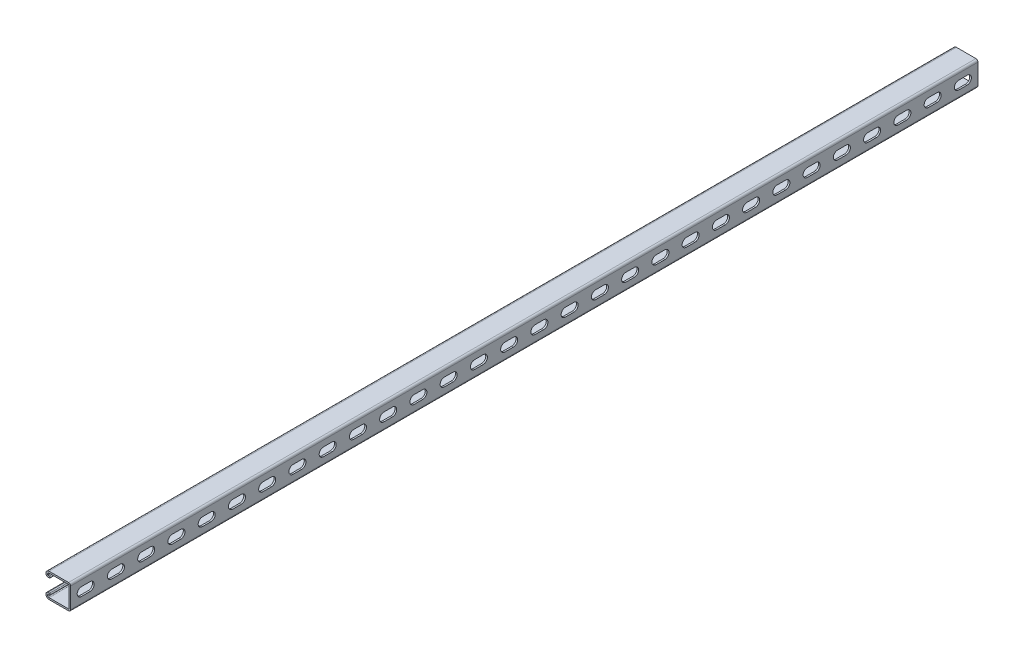
from build123d import *

# Parameters (mm, degrees)
BOSS_EXTRUDE1_DEPTH = 1524
CUT_EXTRUDE1_DEPTH  = 2.794
LPATTERN1_COUNT     = 30
LPATTERN1_PITCH     = 50.8


with BuildPart() as part:
    # Sketch1 → Boss-Extrude1 (new body)
    with BuildSketch(Plane.XY):
        with BuildLine():
            Line((-36.22675, 20.6375), (-3.46075, 20.6375))
            ThreePointArc((-3.46075, 20.6375), (-1.013630207, 19.623869793), (0, 17.17675))
            Line((0, 17.17675), (0, -17.17675))
            ThreePointArc((0, -17.17675), (-1.013630207, -19.623869793), (-3.46075, -20.6375))
            Line((-3.46075, -20.6375), (-36.22675, -20.6375))
            ThreePointArc((-36.22675, -20.6375), (-39.796401808, -19.158901808), (-41.275, -15.58925))
            Line((-41.275, -15.58925), (-41.275, -14.57325))
            ThreePointArc((-41.275, -14.57325), (-40.261369793, -12.126130207), (-37.81425, -11.1125))
            Line((-37.81425, -11.1125), (-35.5346, -11.1125))
            ThreePointArc((-35.5346, -11.1125), (-34.1376, -12.5095), (-35.5346, -13.9065))
            Line((-35.5346, -13.9065), (-37.81425, -13.9065))
            ThreePointArc((-37.81425, -13.9065), (-38.285713446, -14.101786554), (-38.481, -14.57325))
            Line((-38.481, -14.57325), (-38.481, -15.58925))
            ThreePointArc((-38.481, -15.58925), (-37.820745461, -17.183245461), (-36.22675, -17.8435))
            Line((-36.22675, -17.8435), (-3.46075, -17.8435))
            ThreePointArc((-3.46075, -17.8435), (-2.989286554, -17.648213446), (-2.794, -17.17675))
            Line((-2.794, -17.17675), (-2.794, 17.17675))
            ThreePointArc((-2.794, 17.17675), (-2.989286554, 17.648213446), (-3.46075, 17.8435))
            Line((-3.46075, 17.8435), (-36.22675, 17.8435))
            ThreePointArc((-36.22675, 17.8435), (-37.820745461, 17.183245461), (-38.481, 15.58925))
            Line((-38.481, 15.58925), (-38.481, 14.57325))
            ThreePointArc((-38.481, 14.57325), (-38.285713446, 14.101786554), (-37.81425, 13.9065))
            Line((-37.81425, 13.9065), (-35.5346, 13.9065))
            ThreePointArc((-35.5346, 13.9065), (-34.1376, 12.5095), (-35.5346, 11.1125))
            Line((-35.5346, 11.1125), (-37.81425, 11.1125))
            ThreePointArc((-37.81425, 11.1125), (-40.261369793, 12.126130207), (-41.275, 14.57325))
            Line((-41.275, 14.57325), (-41.275, 15.58925))
            ThreePointArc((-41.275, 15.58925), (-39.796401808, 19.158901808), (-36.22675, 20.6375))
        make_face()
    extrude(amount=-BOSS_EXTRUDE1_DEPTH)

    # Sketch2 → Cut-Extrude1 (cut)
    with BuildSketch(Plane(origin=(0, 0, 0), x_dir=(0, 0, -1), z_dir=(1, 0, 0))):
        with BuildLine():
            Line((18.25625, 7.14375), (32.54375, 7.14375))
            ThreePointArc((32.54375, 7.14375), (39.6875, 0), (32.54375, -7.14375))
            Line((32.54375, -7.14375), (18.25625, -7.14375))
            ThreePointArc((18.25625, -7.14375), (11.1125, 0), (18.25625, 7.14375))
        make_face()
    cut_extrude1 = extrude(amount=-CUT_EXTRUDE1_DEPTH, mode=Mode.SUBTRACT)

    # LPattern1: Cut-Extrude1 ×30
    with Locations(*[(0, 0, -i * LPATTERN1_PITCH) for i in range(1, LPATTERN1_COUNT)]):
        add(cut_extrude1, mode=Mode.SUBTRACT)


solid = part.part
